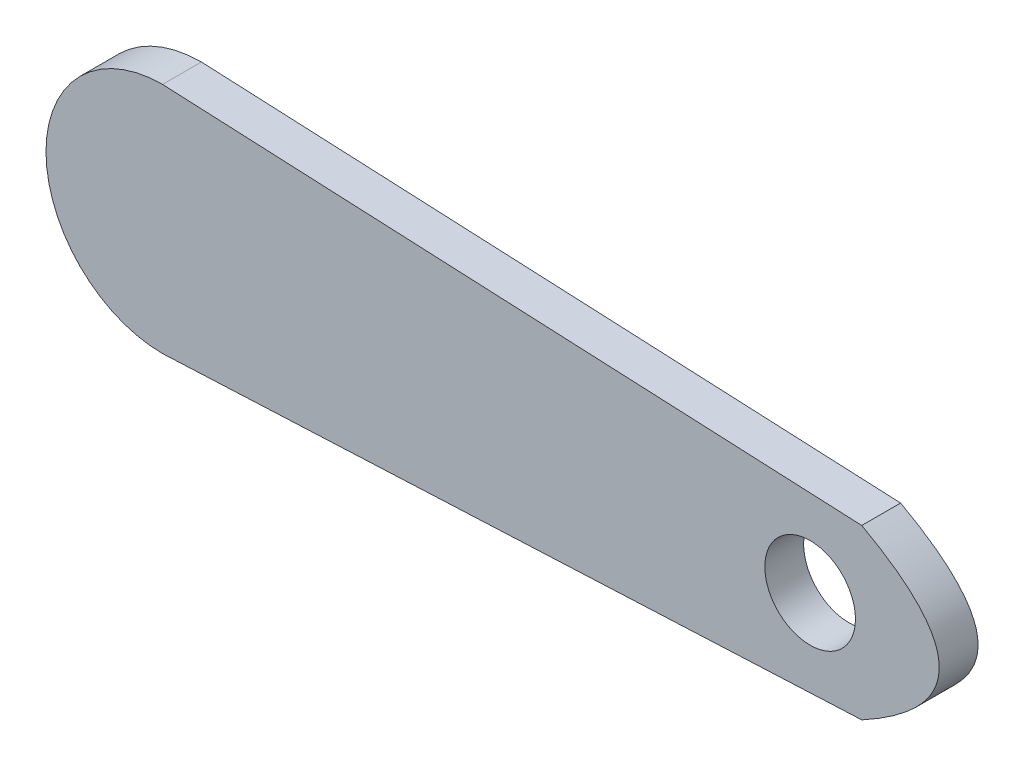
from build123d import *

# Parameters (mm, degrees)
SKETCH1_R           = 3.5
BOSS_EXTRUDE1_DEPTH = 3


with BuildPart() as part:
    # Sketch1 → Boss-Extrude1 (new body)
    with BuildSketch(Plane.XY):
        with BuildLine():
            Line((-25, 9), (28.985507246, 6.5))
            add(Edge.make_bspline(
                [(28.985507246, 6.5), (40.946682853, 0), (28.985507246, -6.5)],
                knots=[0, 0, 0, 1, 1, 1], degree=2))
            Line((28.985507246, -6.5), (-25, -9))
            ThreePointArc((-25, -9), (-34, 0), (-25, 9))
        make_face()
        with Locations((25, 0)):
            Circle(SKETCH1_R, mode=Mode.SUBTRACT)
    extrude(amount=BOSS_EXTRUDE1_DEPTH)


solid = part.part
